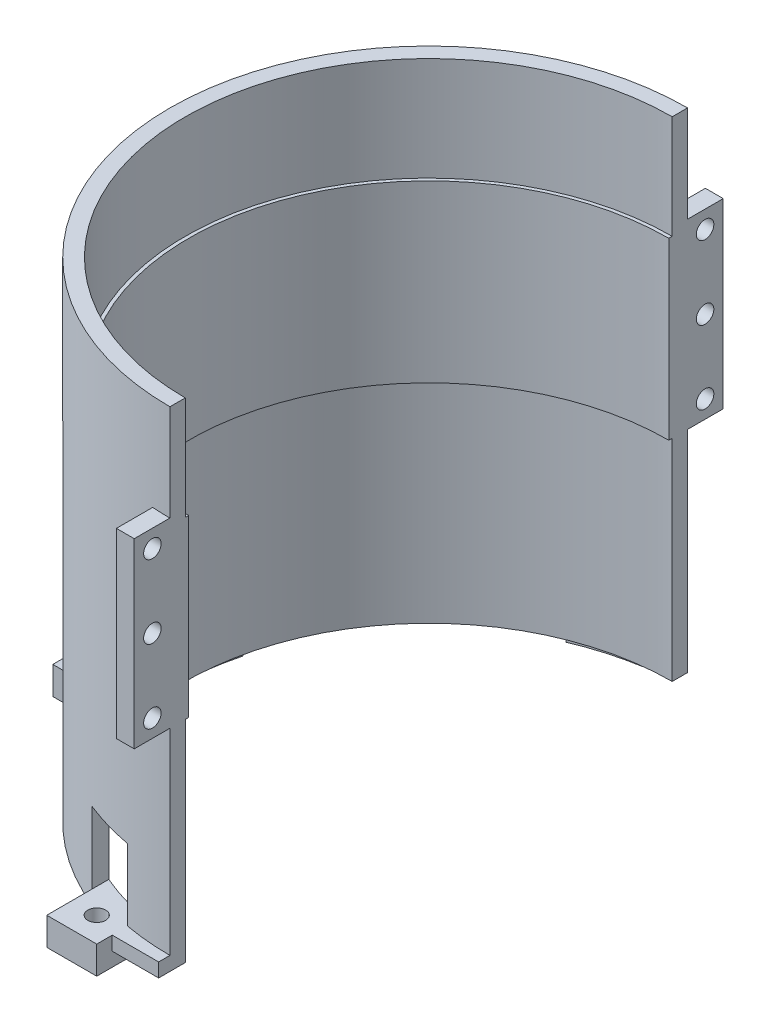
from build123d import *

# Parameters (mm, degrees)
BOSS_EXTRUDE1_DEPTH  = 10
BOSS_EXTRUDE2_START  = 73
BOSS_EXTRUDE2_DEPTH  = 73
SKETCH4_R            = 2.5
BOSS_EXTRUDE3_DEPTH  = 3.9
SKETCH6_R            = 2.45
CUT_EXTRUDE1_DEPTH   = 13.9
SKETCH7_W            = 14
SKETCH7_H            = 20
CUT_EXTRUDE2_DEPTH   = 23.9
BOSS_EXTRUDE4_START  = -3.9
BOSS_EXTRUDE4_DEPTH  = 3.9
SKETCH12_W           = 5
SKETCH12_H           = 10
BOSS_EXTRUDE5_DEPTH  = 0.17
CUT_EXTRUDE3_START   = -73
SKETCH13_R           = 68.75
CUT_EXTRUDE3_DEPTH   = 73
BOSS_EXTRUDE6_DEPTH  = 27
BOSS_EXTRUDE7_DEPTH  = 27
BOSS_EXTRUDE8_DEPTH  = 73
BOSS_EXTRUDE9_START  = -37
BOSS_EXTRUDE9_DEPTH  = 37
BOSS_EXTRUDE10_START = 14
BOSS_EXTRUDE10_DEPTH = 14
CUT_EXTRUDE4_START   = -2
CUT_EXTRUDE4_DEPTH   = 2
SKETCH21_W           = 14
SKETCH21_H           = 20
CUT_EXTRUDE5_DEPTH   = 22
BOSS_EXTRUDE11_START = 14
BOSS_EXTRUDE11_DEPTH = 14
BOSS_EXTRUDE12_START = -5
SKETCH25_R           = 2.45
BOSS_EXTRUDE12_DEPTH = 5
SKETCH24_R           = 2.45
CUT_EXTRUDE6_DEPTH   = 22
BOSS_EXTRUDE13_START = -5
SKETCH26_R           = 2.45
BOSS_EXTRUDE13_DEPTH = 5
BOSS_EXTRUDE14_START = 14
BOSS_EXTRUDE14_DEPTH = 14
SKETCH29_R           = 2.45
CUT_EXTRUDE7_DEPTH   = 22


with BuildPart() as part:
    # Sketch1 → Boss-Extrude1 (new body)
    with BuildSketch(Plane(origin=(0, 0, 0), x_dir=(1, 0, 0), z_dir=(0, 1, 0))):
        with BuildLine():
            Line((0, -67.5), (0, -82.327380707))
            Line((0, -82.327380707), (-5, -82.327380707))
            Line((-5, -82.327380707), (-5, -72.327380707))
            ThreePointArc((-5, -72.327380707), (-72.5, 0), (-5, 72.327380707))
            Line((-5, 72.327380707), (-5, 82.5))
            Line((-5, 82.5), (0, 82.5))
            Line((0, 82.5), (0, 67.5))
            ThreePointArc((0, 67.5), (-67.5, 0), (0, -67.5))
        make_face()
    extrude(amount=BOSS_EXTRUDE1_DEPTH)

    # Sketch2 → Boss-Extrude2 (add)
    with BuildSketch(Plane.XZ.offset(BOSS_EXTRUDE2_START)):
        with BuildLine():
            Line((0, 72.5), (0, 68.5))
            ThreePointArc((0, 68.5), (-68.5, 0), (0, -68.5))
            Line((0, -68.5), (0, -72.5))
            ThreePointArc((0, -72.5), (-72.5, 0), (0, 72.5))
        make_face()
    extrude(amount=-BOSS_EXTRUDE2_DEPTH)

    # Sketch4 → Boss-Extrude3 (add, symmetric)
    # profile 1 of 3: a face of its own
    with BuildSketch(Plane.XZ.offset(73)):
        with BuildLine():
            Line((-70.151512279, 18.30342386), (-87, 18.30342386))
            Line((-87, 18.30342386), (-87, -18.19657614))
            Line((-87, -18.19657614), (-70.179303336, -18.19657614))
            ThreePointArc((-70.179303336, -18.19657614), (-72.499978985, 0.055201399), (-70.151512279, 18.30342386))
        make_face()
        with Locations(Location((-78.75, 10.05342386, 0), (0, 0, 270))):
            Circle(SKETCH4_R, mode=Mode.SUBTRACT)
        with Locations(Location((-78.75, -9.94657614, 0), (0, 0, 270))):
            Circle(SKETCH4_R, mode=Mode.SUBTRACT)
    # profile 2 of 3: a face of its own
    with BuildSketch(Plane.XZ.offset(73)):
        with BuildLine():
            Line((-28.25, -66.769660026), (-28.25, -83.75))
            Line((-28.25, -83.75), (-11.75, -83.75))
            Line((-11.75, -83.75), (-11.75, -71.54150893))
            ThreePointArc((-11.75, -71.54150893), (-20.141813113, -69.645942915), (-28.25, -66.769660026))
        make_face()
        with Locations(Location((-20, -75.5, 0), (0, 0, 270))):
            Circle(SKETCH4_R, mode=Mode.SUBTRACT)
    # profile 3 of 3: a face of its own
    with BuildSketch(Plane.XZ.offset(73)):
        with BuildLine():
            Line((-27, 67.284842275), (-27, 80))
            Line((-27, 80), (-13, 80))
            Line((-13, 80), (-13, 71.324960568))
            ThreePointArc((-13, 71.324960568), (-20.101757111, 69.657514749), (-27, 67.284842275))
        make_face()
        with Locations(Location((-20, 73, 0), (0, 0, 270))):
            Circle(SKETCH4_R, mode=Mode.SUBTRACT)
    extrude(amount=BOSS_EXTRUDE3_DEPTH, both=True)

    # Sketch6 → Cut-Extrude1 (cut)
    with BuildSketch(Plane.ZY.offset(5)):
        with Locations((77.412380707, 5)):
            Circle(SKETCH6_R)
        with Locations((-77.413690354, 5)):
            Circle(SKETCH6_R)
    extrude(amount=-CUT_EXTRUDE1_DEPTH, mode=Mode.SUBTRACT)

    # Sketch7 → Cut-Extrude2 (cut)
    with BuildSketch(Plane.XY.offset(80)):
        with Locations((-20, -59.1)):
            Rectangle(SKETCH7_W, SKETCH7_H)
    extrude(amount=-CUT_EXTRUDE2_DEPTH, mode=Mode.SUBTRACT)

    # Sketch10 → Boss-Extrude4 (add)
    with BuildSketch(Plane(origin=(0, -69.1, 0), x_dir=(1, 0, 0), z_dir=(0, 1, 0)).offset(BOSS_EXTRUDE4_START)):
        with BuildLine():
            Line((-13, -71.324960568), (-13, -75.662480284))
            Line((-13, -75.662480284), (0, -75.662480284))
            Line((0, -75.662480284), (0, -72.5))
            ThreePointArc((0, -72.5), (-6.526498251, -72.205642581), (-13, -71.324960568))
        make_face()
    extrude(amount=BOSS_EXTRUDE4_DEPTH)

    # Sketch12 → Boss-Extrude5 (add)
    with BuildSketch(Plane.XY.offset(82.327380707)):
        with Locations((-2.5, 5)):
            Rectangle(SKETCH12_W, SKETCH12_H)
    extrude(amount=BOSS_EXTRUDE5_DEPTH)

    # Sketch13 → Cut-Extrude3 (cut)
    with BuildSketch(Plane.XZ.offset(73).offset(CUT_EXTRUDE3_START)):
        Circle(SKETCH13_R)
    extrude(amount=CUT_EXTRUDE3_DEPTH, mode=Mode.SUBTRACT)

    # Sketch14 → Boss-Extrude6 (add)
    with BuildSketch(Plane(origin=(0, 10, 0), x_dir=(1, 0, 0), z_dir=(0, 1, 0))):
        with BuildLine():
            Line((-5, -72.327380707), (-5, -82.497380707))
            Line((-5, -82.497380707), (0, -82.497380707))
            Line((0, -82.497380707), (0, -67.5))
            ThreePointArc((0, -67.5), (-67.5, 0), (0, 67.5))
            Line((0, 67.5), (0, 82.5))
            Line((0, 82.5), (-5, 82.5))
            Line((-5, 82.5), (-5, 72.327380707))
            ThreePointArc((-5, 72.327380707), (-72.5, 0), (-5, -72.327380707))
        make_face()
    extrude(amount=BOSS_EXTRUDE6_DEPTH)

    # Sketch15 → Boss-Extrude7 (add)
    with BuildSketch(Plane(origin=(0, 37, 0), x_dir=(1, 0, 0), z_dir=(0, 1, 0))):
        with BuildLine():
            Line((0, 68.2), (0, 72.5))
            ThreePointArc((0, 72.5), (-72.5, 0), (0, -72.5))
            Line((0, -72.5), (0, -68.2))
            ThreePointArc((0, -68.2), (-68.2, 0), (0, 68.2))
        make_face()
    extrude(amount=BOSS_EXTRUDE7_DEPTH)

    # Sketch17 → Boss-Extrude8 (add)
    with BuildSketch(Plane.XZ):
        with BuildLine():
            Line((0, 68.2), (0, 68.75))
            ThreePointArc((0, 68.75), (-68.75, 0), (0, -68.75))
            Line((0, -68.75), (0, -68.2))
            ThreePointArc((0, -68.2), (-68.2, 0), (0, 68.2))
        make_face()
    extrude(amount=BOSS_EXTRUDE8_DEPTH)

    # Sketch18 → Boss-Extrude9 (add)
    with BuildSketch(Plane(origin=(0, 37, 0), x_dir=(1, 0, 0), z_dir=(0, 1, 0)).offset(BOSS_EXTRUDE9_START)):
        with BuildLine():
            Line((0, -67.25), (0, -67.5))
            ThreePointArc((0, -67.5), (-67.5, 0), (0, 67.5))
            Line((0, 67.5), (0, 67.25))
            ThreePointArc((0, 67.25), (-67.25, 0), (0, -67.25))
        make_face()
    extrude(amount=BOSS_EXTRUDE9_DEPTH)

    # Sketch19 → Boss-Extrude10 (add)
    with BuildSketch(Plane.XZ.offset(BOSS_EXTRUDE10_START)):
        with BuildLine():
            Line((0, -68.2), (0, -67.25))
            ThreePointArc((0, -67.25), (-67.25, 0), (0, 67.25))
            Line((0, 67.25), (0, 68.2))
            ThreePointArc((0, 68.2), (-68.2, 0), (0, -68.2))
        make_face()
    extrude(amount=-BOSS_EXTRUDE10_DEPTH)

    # Sketch20 → Cut-Extrude4 (cut)
    with BuildSketch(Plane(origin=(0, 37, 0), x_dir=(1, 0, 0), z_dir=(0, 1, 0)).offset(CUT_EXTRUDE4_START)):
        with BuildLine():
            Line((0, 67.25), (0, 68.2))
            ThreePointArc((0, 68.2), (-68.2, 0), (0, -68.2))
            Line((0, -68.2), (0, -67.25))
            ThreePointArc((0, -67.25), (-67.25, 0), (0, 67.25))
        make_face()
    extrude(amount=CUT_EXTRUDE4_DEPTH, mode=Mode.SUBTRACT)

    # Sketch21 → Cut-Extrude5 (cut)
    with BuildSketch(Plane.XY.offset(80)):
        with Locations((-20, -59.1)):
            Rectangle(SKETCH21_W, SKETCH21_H)
    extrude(amount=-CUT_EXTRUDE5_DEPTH, mode=Mode.SUBTRACT)

    # Sketch23 → Boss-Extrude11 (add)
    with BuildSketch(Plane.XZ.offset(BOSS_EXTRUDE11_START)):
        with BuildLine():
            Line((0, 72.5), (0, 82.497380707))
            Line((0, 82.497380707), (-5, 82.497380707))
            Line((-5, 82.497380707), (-5, 72.327380707))
            ThreePointArc((-5, 72.327380707), (-2.501489427, 72.456832325), (0, 72.5))
        make_face()
    extrude(amount=-BOSS_EXTRUDE11_DEPTH)

    # Sketch25 → Boss-Extrude12 (add)
    with BuildSketch(Plane(origin=(0, 0, 0), x_dir=(0, 0, -1), z_dir=(1, 0, 0)).offset(BOSS_EXTRUDE12_START)):
        with Locations((-77.412380707, 5)):
            Circle(SKETCH25_R)
    extrude(amount=BOSS_EXTRUDE12_DEPTH)

    # Sketch24 → Cut-Extrude6 (cut)
    with BuildSketch(Plane(origin=(0, 0, 0), x_dir=(0, 0, -1), z_dir=(1, 0, 0))):
        with Locations((-77.412380707, -9.05)):
            Circle(SKETCH24_R)
        with Locations((-77.412380707, 32.05)):
            Circle(SKETCH24_R)
        with Locations((-77.412380707, 11.5)):
            Circle(SKETCH24_R)
    extrude(amount=-CUT_EXTRUDE6_DEPTH, mode=Mode.SUBTRACT)

    # Sketch26 → Boss-Extrude13 (add)
    with BuildSketch(Plane(origin=(0, 0, 0), x_dir=(0, 0, -1), z_dir=(1, 0, 0)).offset(BOSS_EXTRUDE13_START)):
        with Locations((77.413690354, 5)):
            Circle(SKETCH26_R)
    extrude(amount=BOSS_EXTRUDE13_DEPTH)

    # Sketch27 → Boss-Extrude14 (add)
    with BuildSketch(Plane.XZ.offset(BOSS_EXTRUDE14_START)):
        with BuildLine():
            Line((-5, -72.327380707), (-5, -82.5))
            Line((-5, -82.5), (0, -82.5))
            Line((0, -82.5), (0, -72.5))
            ThreePointArc((0, -72.5), (-2.501489427, -72.456832325), (-5, -72.327380707))
        make_face()
    extrude(amount=-BOSS_EXTRUDE14_DEPTH)

    # Sketch29 → Cut-Extrude7 (cut)
    with BuildSketch(Plane(origin=(0, 0, 0), x_dir=(0, 0, -1), z_dir=(1, 0, 0))):
        with Locations((77.41, 32.05)):
            Circle(SKETCH29_R)
        with Locations((77.41, 11.5)):
            Circle(SKETCH29_R)
        with Locations((77.41, -9.05)):
            Circle(SKETCH29_R)
    extrude(amount=-CUT_EXTRUDE7_DEPTH, mode=Mode.SUBTRACT)


solid = part.part
